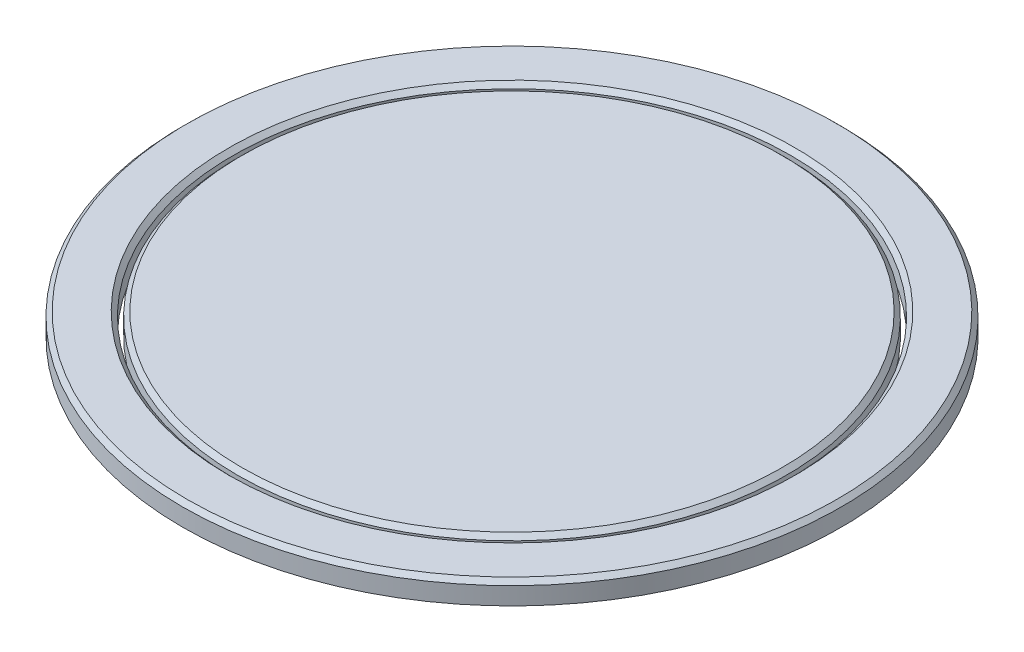
from build123d import *

# Parameters (mm, degrees)
SKETCH_1_R        = 30
SKETCH_1_R_2      = 25.4
EXTRUDE_1_DEPTH   = 2
SKETCH_1_R_3      = 25
EXTRUDE_1_2_DEPTH = 2
CHAMFER_2_SIZE    = 0.4
CHAMFER_3_SIZE    = 0.4


with BuildPart() as part:
    # 草图1 → 凸台-拉伸1 (new body)
    with BuildSketch(Plane(origin=(0, 0, 0), x_dir=(1, 0, 0), z_dir=(0, 1, 0))):
        with Locations(Location((0, 0, 0), (0, 0, 270))):
            Circle(SKETCH_1_R)
        with Locations(Location((0, 0, 0), (0, 0, 270))):
            Circle(SKETCH_1_R_2, mode=Mode.SUBTRACT)
    extrude(amount=EXTRUDE_1_DEPTH)

    # 倒角2
    chamfer_2_edges = [part.edges().sort_by_distance(p)[0] for p in [
        (0, 2, -30),
        (0, 2, -25.4),
    ]]
    chamfer(chamfer_2_edges, length=CHAMFER_2_SIZE)


with BuildPart() as body_2:
    # 草图1 → Extrude 1 2 (new body)
    with BuildSketch(Plane(origin=(0, 0, 0), x_dir=(1, 0, 0), z_dir=(0, 1, 0))):
        with Locations(Location((0, 0, 0), (0, 0, 270))):
            Circle(SKETCH_1_R_3)
    extrude(amount=EXTRUDE_1_2_DEPTH)

    # 倒角3
    chamfer_3_edges = [body_2.edges().sort_by_distance(p)[0] for p in [
        (0, 2, -25),
    ]]
    chamfer(chamfer_3_edges, length=CHAMFER_3_SIZE)


solid = Compound([part.part, body_2.part])
